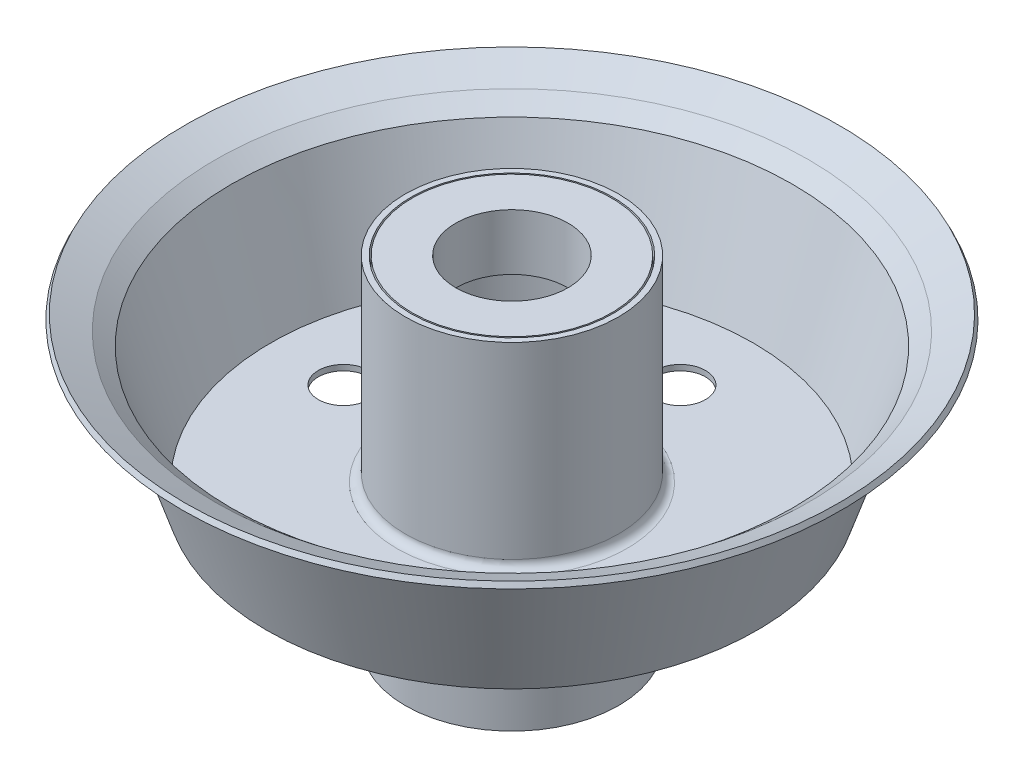
from build123d import *

# Parameters (mm, degrees)
SKETCH_2_R            = 4.5
CUT_EXTRUDE_1_DEPTH   = 40
EXTRUDE_10_DEPTH      = 35
EXTRUDE_10_DEPTH_BACK = 25
SKETCH_3_R            = 19
SKETCH_3_R_2          = 18
FILLET_2_R            = 1.5
EXTRUDE_START         = 25
SKETCH_4_R            = 17.75
SKETCH_4_R_2          = 10
EXTRUDE_11_DEPTH      = 10
EXTRUDE_START_2       = -15
SKETCH_4_2_R          = 17.75
SKETCH_4_2_R_2        = 10
EXTRUDE_12_DEPTH      = 10
SKETCH_6_R            = 3
CUT_EXTRUDE_13_DEPTH  = 15


with BuildPart() as part:
    # Эскиз1 → Повернуть-Тонкостенный1 (revolve)
    with BuildSketch(Plane.XY, mode=Mode.PRIVATE) as revolve_1_sk:
        Polygon((19, 0), (43, 0), (50, 21), (52.889577147, 23.332201276), (58.302767501, 25.953006302), (58.738533119, 25.052946123), (53.42847461, 22.482072549), (50.856038751, 20.405838593), (43.72075922, -1), (19, -1), align=None)
    revolve(revolve_1_sk.sketch.rotate(Axis((0, 0, 0), (0, -1, 0)), 90), axis=Axis((0, 0, 0), (0, -1, 0)))

    # Эскиз2 → Вытянуть1 (cut, symmetric)
    with BuildSketch(Plane(origin=(0, 0, 0), x_dir=(1, 0, 0), z_dir=(0, 1, 0))):
        with Locations(Location((30, 0, 0), (0, 0, 270))):
            Circle(SKETCH_2_R)
        with Locations(Location((-30, 0, 0), (0, 0, 270))):
            Circle(SKETCH_2_R)
        with Locations(Location((0, 30, 0), (0, 0, 270))):
            Circle(SKETCH_2_R)
        with Locations(Location((0, -30, 0), (0, 0, 270))):
            Circle(SKETCH_2_R)
    extrude(amount=CUT_EXTRUDE_1_DEPTH, both=True, mode=Mode.SUBTRACT)

    # Эскиз3 → Вытянуть10 (add, two sides: drawn at the far end of the back side and taken through both)
    with BuildSketch(Plane(origin=(0, 0, 0), x_dir=(1, 0, 0), z_dir=(0, 1, 0)).offset(-EXTRUDE_10_DEPTH_BACK)):
        with Locations(Location((0, 0, 0), (0, 0, 270))):
            Circle(SKETCH_3_R)
        with Locations(Location((0, 0, 0), (0, 0, 270))):
            Circle(SKETCH_3_R_2, mode=Mode.SUBTRACT)
    extrude(amount=EXTRUDE_10_DEPTH + EXTRUDE_10_DEPTH_BACK)

    # Скругление2
    fillet_2_edges = [part.edges().sort_by_distance(p)[0] for p in [
        (0, 0, -19),
    ]]
    fillet(fillet_2_edges, radius=FILLET_2_R)

    # Эскиз6 → Вытянуть13 (cut, symmetric)
    with BuildSketch(Plane(origin=(0, 0, 0), x_dir=(1, 0, 0), z_dir=(0, 1, 0))):
        with Locations(Location((-22.360679775, 20, 0), (0, 0, 270))):
            Circle(SKETCH_6_R)
        with Locations(Location((22.360679775, -20, 0), (0, 0, 270))):
            Circle(SKETCH_6_R)
    extrude(amount=CUT_EXTRUDE_13_DEPTH, both=True, mode=Mode.SUBTRACT)


with BuildPart() as body_2:
    # Эскиз4 → Вытянуть11 (new body)
    with BuildSketch(Plane(origin=(0, 0, 0), x_dir=(1, 0, 0), z_dir=(0, 1, 0)).offset(EXTRUDE_START)):
        with Locations(Location((0, 0, 0), (0, 0, 270))):
            Circle(SKETCH_4_R)
        with Locations(Location((0, 0, 0), (0, 0, 270))):
            Circle(SKETCH_4_R_2, mode=Mode.SUBTRACT)
    extrude(amount=EXTRUDE_11_DEPTH)


with BuildPart() as body_3:
    # Эскиз4<2> → Вытянуть12 (new body)
    with BuildSketch(Plane(origin=(0, 0, 0), x_dir=(1, 0, 0), z_dir=(0, 1, 0)).offset(EXTRUDE_START_2)):
        with Locations(Location((0, 0, 0), (0, 0, 270))):
            Circle(SKETCH_4_2_R)
        with Locations(Location((0, 0, 0), (0, 0, 270))):
            Circle(SKETCH_4_2_R_2, mode=Mode.SUBTRACT)
    extrude(amount=-EXTRUDE_12_DEPTH)


solid = Compound([part.part, body_2.part, body_3.part])
